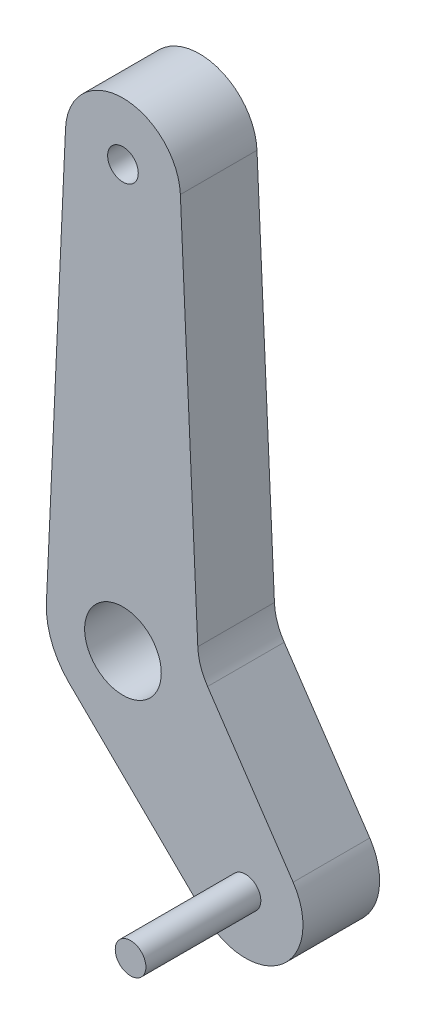
from build123d import *

# Parameters (mm, degrees)
SKETCH_1_R      = 10
SKETCH_1_R_2    = 4
EXTRUDE_1_DEPTH = 20
SKETCH_3_R      = 4
EXTRUDE_2_DEPTH = 30


with BuildPart() as part:
    # 草图1 → 凸台-拉伸1 (new body)
    with BuildSketch(Plane.XY):
        with BuildLine():
            Line((-14.98449612, 110.681818182), (-19.97932816, 0.909090909))
            ThreePointArc((-19.97932816, 0.909090909), (-18.614490773, -7.314419545), (-14.01590192, -14.267252481))
            Line((-14.01590192, -14.267252481), (21.473440532, -49.131368307))
            ThreePointArc((21.473440532, -49.131368307), (41.580977064, -49.96020763), (44.416415431, -30.036345322))
            Line((44.416415431, -30.036345322), (22.085208252, 3.03263475))
            ThreePointArc((22.085208252, 3.03263475), (20.276358226, 6.712847666), (19.53176059, 10.745400192))
            Line((19.53176059, 10.745400192), (14.98449612, 110.681818182))
            ThreePointArc((14.98449612, 110.681818182), (0, 125), (-14.98449612, 110.681818182))
        make_face()
        Circle(SKETCH_1_R, mode=Mode.SUBTRACT)
        with Locations((0, 110)):
            Circle(SKETCH_1_R_2, mode=Mode.SUBTRACT)
    extrude(amount=EXTRUDE_1_DEPTH)

    # 草图3 → 凸台-拉伸2 (add)
    with BuildSketch(Plane.XY.offset(20)):
        with Locations(Location((31.985366972, -38.430928946, 0), (0, 0, 180))):
            Circle(SKETCH_3_R)
    extrude(amount=EXTRUDE_2_DEPTH)


solid = part.part
